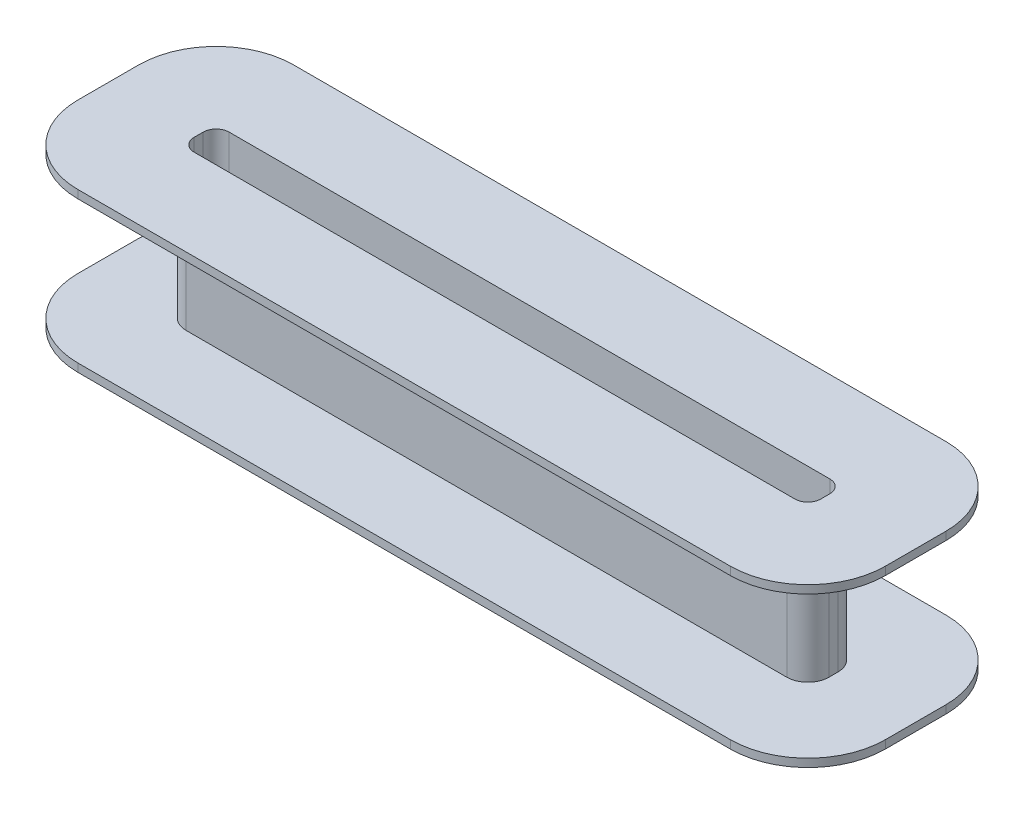
from build123d import *

# Parameters (mm, degrees)
SKETCH1_W           = 79.375
SKETCH1_H           = 21.209
SKETCH1_W_2         = 61.595
SKETCH1_H_2         = 3.429
BOSS_EXTRUDE1_DEPTH = 0.8
FILLET1_R           = 1.27
FILLET2_R           = 7.62
BOSS_EXTRUDE2_START = 13.97
BOSS_EXTRUDE2_DEPTH = 13.97
BOSS_EXTRUDE3_START = 0.8
BOSS_EXTRUDE3_DEPTH = 0.8


with BuildPart() as part:
    # Sketch1 → Boss-Extrude1 (new body)
    with BuildSketch(Plane(origin=(0, 0, 0), x_dir=(1, 0, 0), z_dir=(0, 1, 0))):
        Rectangle(SKETCH1_W, SKETCH1_H)
        Rectangle(SKETCH1_W_2, SKETCH1_H_2, mode=Mode.SUBTRACT)
    extrude(amount=BOSS_EXTRUDE1_DEPTH)

    # Fillet1
    fillet1_edges = [part.edges().sort_by_distance(p)[0] for p in [
        (30.7975, 0.4, 1.7145),
        (30.7975, 0.4, -1.7145),
        (-30.7975, 0.4, -1.7145),
        (-30.7975, 0.4, 1.7145),
    ]]
    fillet(fillet1_edges, radius=FILLET1_R)

    # Fillet2
    fillet2_edges = [part.edges().sort_by_distance(p)[0] for p in [
        (39.6875, 0.4, 10.6045),
        (-39.6875, 0.4, 10.6045),
        (-39.6875, 0.4, -10.6045),
        (39.6875, 0.4, -10.6045),
    ]]
    fillet(fillet2_edges, radius=FILLET2_R)

    # Sketch2 → Boss-Extrude2 (add)
    with BuildSketch(Plane(origin=(0, 0.8, 0), x_dir=(1, 0, 0), z_dir=(0, 1, 0)).offset(BOSS_EXTRUDE2_START)):
        with BuildLine():
            Line((29.5275, 2.5145), (-29.5275, 2.5145))
            ThreePointArc((-29.5275, 2.5145), (-30.991211037, 1.908211037), (-31.5975, 0.4445))
            Line((-31.5975, 0.4445), (-31.5975, -0.4445))
            ThreePointArc((-31.5975, -0.4445), (-30.991211037, -1.908211037), (-29.5275, -2.5145))
            Line((-29.5275, -2.5145), (29.5275, -2.5145))
            ThreePointArc((29.5275, -2.5145), (30.991211037, -1.908211037), (31.5975, -0.4445))
            Line((31.5975, -0.4445), (31.5975, 0.4445))
            ThreePointArc((31.5975, 0.4445), (30.991211037, 1.908211037), (29.5275, 2.5145))
        make_face()
        with BuildLine():
            Line((30.7975, -0.4445), (30.7975, 0.4445))
            ThreePointArc((30.7975, 0.4445), (30.425525612, 1.342525612), (29.5275, 1.7145))
            Line((29.5275, 1.7145), (-29.5275, 1.7145))
            ThreePointArc((-29.5275, 1.7145), (-30.425525612, 1.342525612), (-30.7975, 0.4445))
            Line((-30.7975, 0.4445), (-30.7975, -0.4445))
            ThreePointArc((-30.7975, -0.4445), (-30.425525612, -1.342525612), (-29.5275, -1.7145))
            Line((-29.5275, -1.7145), (29.5275, -1.7145))
            ThreePointArc((29.5275, -1.7145), (30.425525612, -1.342525612), (30.7975, -0.4445))
        make_face(mode=Mode.SUBTRACT)
    extrude(amount=-BOSS_EXTRUDE2_DEPTH)

    # Sketch3 → Boss-Extrude3 (add)
    with BuildSketch(Plane(origin=(0, 14.77, 0), x_dir=(1, 0, 0), z_dir=(0, 1, 0)).offset(BOSS_EXTRUDE3_START)):
        with BuildLine():
            Line((-32.0675, -10.6045), (32.0675, -10.6045))
            ThreePointArc((32.0675, -10.6045), (37.455653673, -8.372653673), (39.6875, -2.9845))
            Line((39.6875, -2.9845), (39.6875, 2.9845))
            ThreePointArc((39.6875, 2.9845), (37.455653673, 8.372653673), (32.0675, 10.6045))
            Line((32.0675, 10.6045), (-32.0675, 10.6045))
            ThreePointArc((-32.0675, 10.6045), (-37.455653673, 8.372653673), (-39.6875, 2.9845))
            Line((-39.6875, 2.9845), (-39.6875, -2.9845))
            ThreePointArc((-39.6875, -2.9845), (-37.455653673, -8.372653673), (-32.0675, -10.6045))
        make_face()
        with BuildLine():
            Line((29.5275, 1.7145), (-29.5275, 1.7145))
            ThreePointArc((-29.5275, 1.7145), (-30.425525612, 1.342525612), (-30.7975, 0.4445))
            Line((-30.7975, 0.4445), (-30.7975, -0.4445))
            ThreePointArc((-30.7975, -0.4445), (-30.425525612, -1.342525612), (-29.5275, -1.7145))
            Line((-29.5275, -1.7145), (29.5275, -1.7145))
            ThreePointArc((29.5275, -1.7145), (30.425525612, -1.342525612), (30.7975, -0.4445))
            Line((30.7975, -0.4445), (30.7975, 0.4445))
            ThreePointArc((30.7975, 0.4445), (30.425525612, 1.342525612), (29.5275, 1.7145))
        make_face(mode=Mode.SUBTRACT)
    extrude(amount=-BOSS_EXTRUDE3_DEPTH)


solid = part.part
